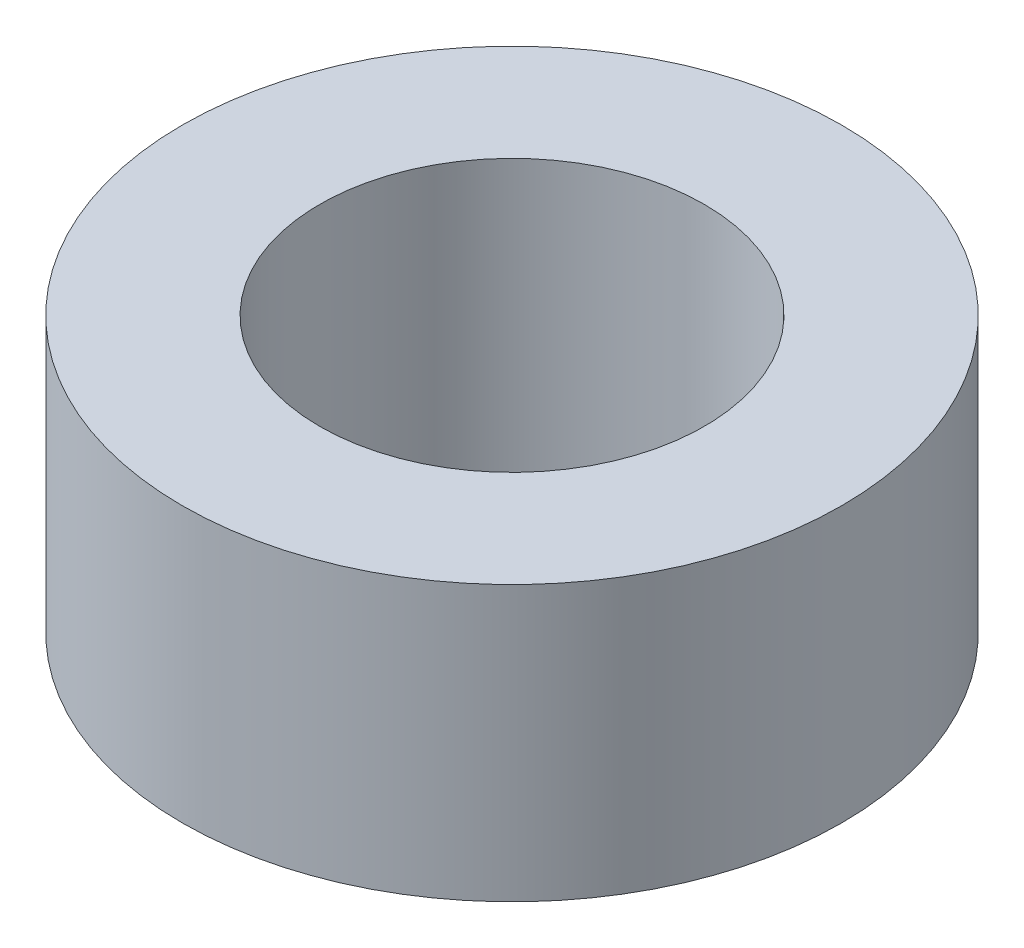
from build123d import *

# Parameters (mm, degrees)
SKETCH1_R           = 6
SKETCH1_R_2         = 3.5
BOSS_EXTRUDE1_DEPTH = 5


with BuildPart() as part:
    # Sketch1 → Boss-Extrude1 (new body)
    with BuildSketch(Plane(origin=(0, 0, 0), x_dir=(1, 0, 0), z_dir=(0, 1, 0))):
        with Locations(Location((0, 0, 0), (0, 0, 270))):
            Circle(SKETCH1_R)
        with Locations(Location((0, 0, 0), (0, 0, 270))):
            Circle(SKETCH1_R_2, mode=Mode.SUBTRACT)
    extrude(amount=BOSS_EXTRUDE1_DEPTH)


solid = part.part
